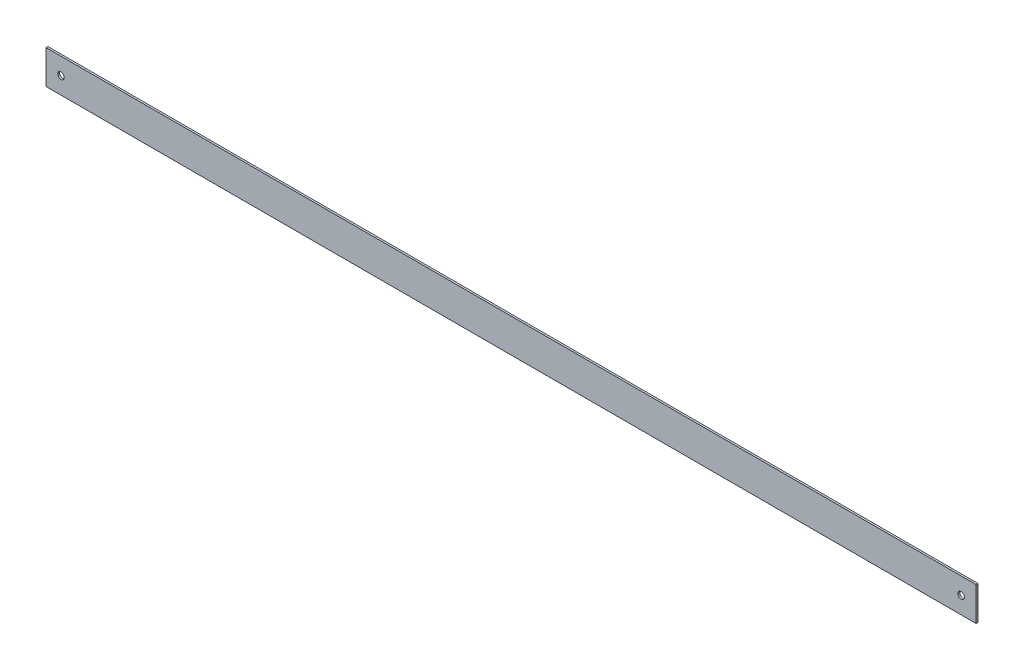
from build123d import *

# Parameters (mm, degrees)
SKETCH1_W            = 787.4
SKETCH1_H            = 28.575
BOSS_EXTRUDE1_DEPTH  = 1.5875
M5_CLEARANCE_HOLE1_D = 5.5


with BuildPart() as part:
    # Sketch1 → Boss-Extrude1 (new body)
    with BuildSketch(Plane.XY):
        with Locations((393.7, 14.2875)):
            Rectangle(SKETCH1_W, SKETCH1_H)
    extrude(amount=BOSS_EXTRUDE1_DEPTH)

    # M5 Clearance Hole1 (through all)
    with Locations(Plane.XY.offset(1.5875)):
        with Locations((12.7, 14.2875)):
            m5_clearance_hole1 = Hole(M5_CLEARANCE_HOLE1_D / 2)

    # Mirror1: M5 Clearance Hole1 across plane
    add(m5_clearance_hole1.mirror(Plane(origin=(393.7, 0, 0), x_dir=(0, 0, 1), z_dir=(1, 0, 0))), mode=Mode.SUBTRACT)


solid = part.part
